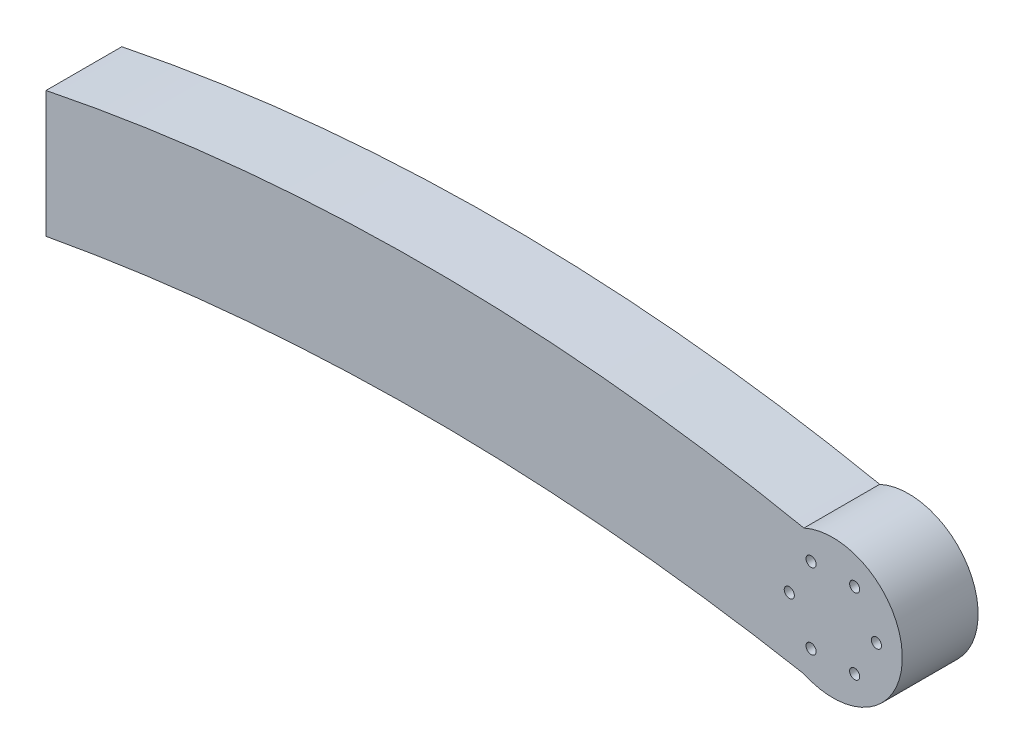
from build123d import *

# Parameters (mm, degrees)
EXTRUDE_1_DEPTH     = 30
SKETCH_2_R          = 2
CUT_EXTRUDE_1_DEPTH = 196.491190428


with BuildPart() as part:
    # 草图1 → 凸台-拉伸1 (new body)
    with BuildSketch(Plane.XY):
        with BuildLine():
            Line((150, 25), (-150, 25))
            Line((-150, 25), (-150, -25))
            ThreePointArc((-150, -25), (0, -11.248129774), (150, -25))
            ThreePointArc((150, -25), (133.956439237, 0), (150, 25))
        make_face()
        with BuildLine():
            ThreePointArc((-150, 25), (0, 40.153077165), (150, 25))
            Line((150, 25), (-150, 25))
        make_face()
        with BuildLine():
            ThreePointArc((188.956439237, 0), (176.309013441, 23.14413618), (150, 25))
            Line((150, 25), (150, -25))
            ThreePointArc((150, -25), (176.309013441, -23.14413618), (188.956439237, 0))
        make_face()
        with BuildLine():
            Line((150, -25), (150, 25))
            ThreePointArc((150, 25), (133.956439237, 0), (150, -25))
        make_face()
    extrude(amount=EXTRUDE_1_DEPTH)

    # 草图2 → 切除-拉伸1 (cut, through all)
    with BuildSketch(Plane.XY.offset(30)):
        with Locations((178.706439237, 0)):
            Circle(SKETCH_2_R)
        with Locations((170.081439237, -14.938938215)):
            Circle(SKETCH_2_R)
        with Locations((152.831439237, -14.938938215)):
            Circle(SKETCH_2_R)
        with Locations((144.206439237, 0)):
            Circle(SKETCH_2_R)
        with Locations((152.831439237, 14.938938215)):
            Circle(SKETCH_2_R)
        with Locations((170.081439237, 14.938938215)):
            Circle(SKETCH_2_R)
    extrude(amount=-CUT_EXTRUDE_1_DEPTH, mode=Mode.SUBTRACT)


solid = part.part
